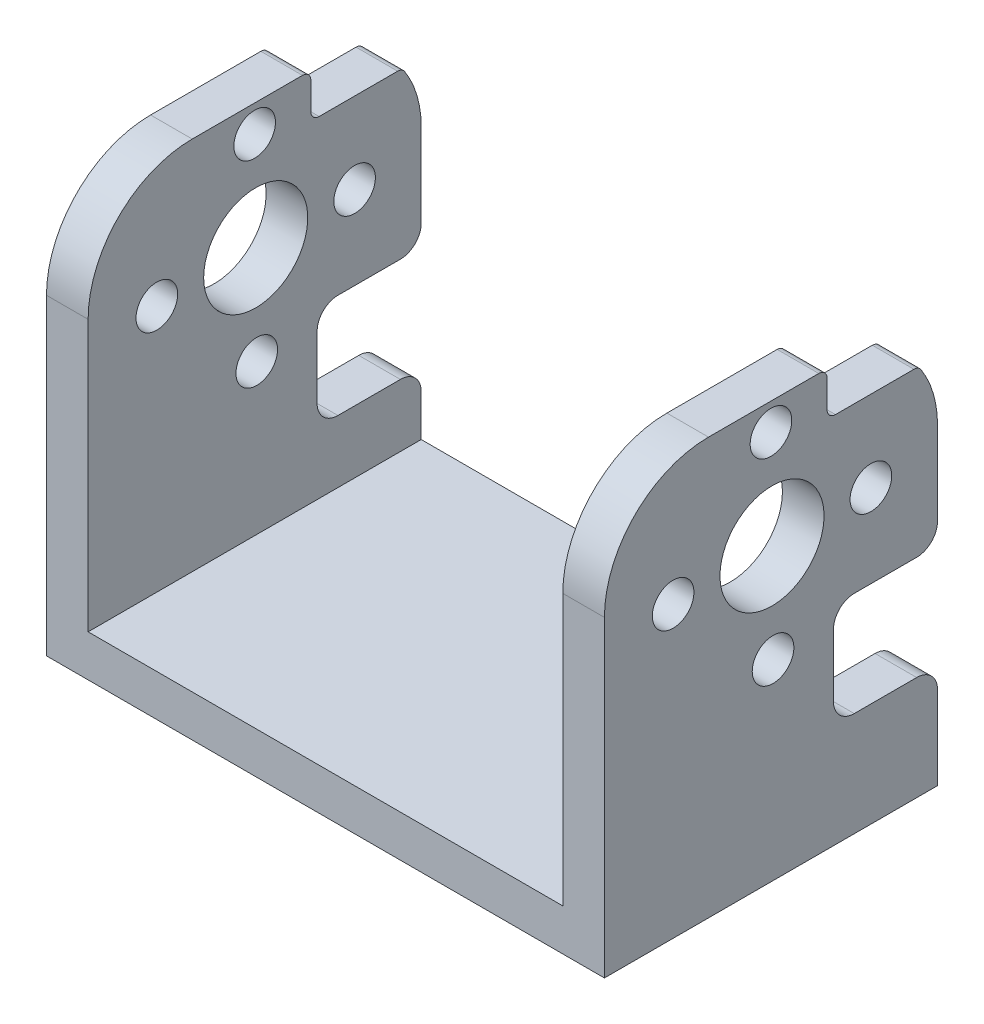
from build123d import *

# Parameters (mm, degrees)
SKETCH1_W           = 34.036
SKETCH1_H           = 20.32
BOSS_EXTRUDE1_DEPTH = 25.4
SKETCH2_W           = 28.956
SKETCH2_H           = 20.32
CUT_EXTRUDE1_DEPTH  = 22.86
SKETCH3_R           = 1.27
SKETCH3_R_2         = 3.175
CUT_EXTRUDE2_DEPTH  = 44.667320687
FILLET2_R           = 6.35
SKETCH8_W           = 6.35
SKETCH8_H           = 6.35
CUT_EXTRUDE5_DEPTH  = 44.667320687
FILLET4_R           = 1.27
SKETCH10_W          = 10.777132928
SKETCH10_H          = 6.217576688
CUT_EXTRUDE6_DEPTH  = 44.667320687
FILLET6_R           = 0.508


with BuildPart() as part:
    # Sketch1 → Boss-Extrude1 (new body)
    with BuildSketch(Plane(origin=(0, 0, 0), x_dir=(1, 0, 0), z_dir=(0, 1, 0))):
        Rectangle(SKETCH1_W, SKETCH1_H)
    extrude(amount=BOSS_EXTRUDE1_DEPTH)

    # Sketch2 → Cut-Extrude1 (cut)
    with BuildSketch(Plane(origin=(0, 25.4, 0), x_dir=(1, 0, 0), z_dir=(0, 1, 0))):
        Rectangle(SKETCH2_W, SKETCH2_H)
    extrude(amount=-CUT_EXTRUDE1_DEPTH, mode=Mode.SUBTRACT)

    # Sketch3 → Cut-Extrude2 (cut, through all)
    with BuildSketch(Plane.ZY.offset(17.018)):
        with Locations((0, 23.749)):
            Circle(SKETCH3_R)
        with Locations((-6.096, 17.78)):
            Circle(SKETCH3_R)
        with Locations((-0.127, 11.684)):
            Circle(SKETCH3_R)
        with Locations((5.969, 17.653)):
            Circle(SKETCH3_R)
        with Locations((-0.0635, 17.7165)):
            Circle(SKETCH3_R_2)
    extrude(amount=-CUT_EXTRUDE2_DEPTH, mode=Mode.SUBTRACT)

    # Fillet2
    fillet2_edges = [part.edges().sort_by_distance(p)[0] for p in [
        (-15.748, 25.4, -10.16),
        (15.748, 25.4, 10.16),
        (-15.748, 25.4, 10.16),
        (15.748, 25.4, -10.16),
    ]]
    fillet(fillet2_edges, radius=FILLET2_R)

    # Sketch8 → Cut-Extrude5 (cut, through all)
    with BuildSketch(Plane(origin=(17.018, 0, 0), x_dir=(0, 0, -1), z_dir=(1, 0, 0))):
        with Locations((6.985, 9.525)):
            Rectangle(SKETCH8_W, SKETCH8_H)
    extrude(amount=-CUT_EXTRUDE5_DEPTH, mode=Mode.SUBTRACT)

    # Fillet4
    fillet4_edges = [part.edges().sort_by_distance(p)[0] for p in [
        (15.748, 12.7, -10.16),
        (-15.748, 12.7, -10.16),
        (15.748, 6.35, -10.16),
        (-15.748, 6.35, -10.16),
        (15.748, 6.35, -3.81),
        (-15.748, 6.35, -3.81),
        (15.748, 12.7, -3.81),
        (-15.748, 12.7, -3.81),
    ]]
    fillet(fillet4_edges, radius=FILLET4_R)

    # Sketch10 → Cut-Extrude6 (cut, through all)
    with BuildSketch(Plane(origin=(17.018, 0, 0), x_dir=(0, 0, -1), z_dir=(1, 0, 0))):
        with Locations((8.813956002, 25.827034075)):
            Rectangle(SKETCH10_W, SKETCH10_H)
    extrude(amount=-CUT_EXTRUDE6_DEPTH, mode=Mode.SUBTRACT)

    # Fillet6
    fillet6_edges = [part.edges().sort_by_distance(p)[0] for p in [
        (-15.748, 22.718245731, -8.993287881),
        (15.748, 25.4, -3.425389538),
        (15.748, 22.718245731, -3.425389538),
        (-15.748, 25.4, -3.425389538),
        (-15.748, 22.718245731, -3.425389538),
        (15.748, 22.718245731, -8.993287881),
    ]]
    fillet(fillet6_edges, radius=FILLET6_R)


solid = part.part
